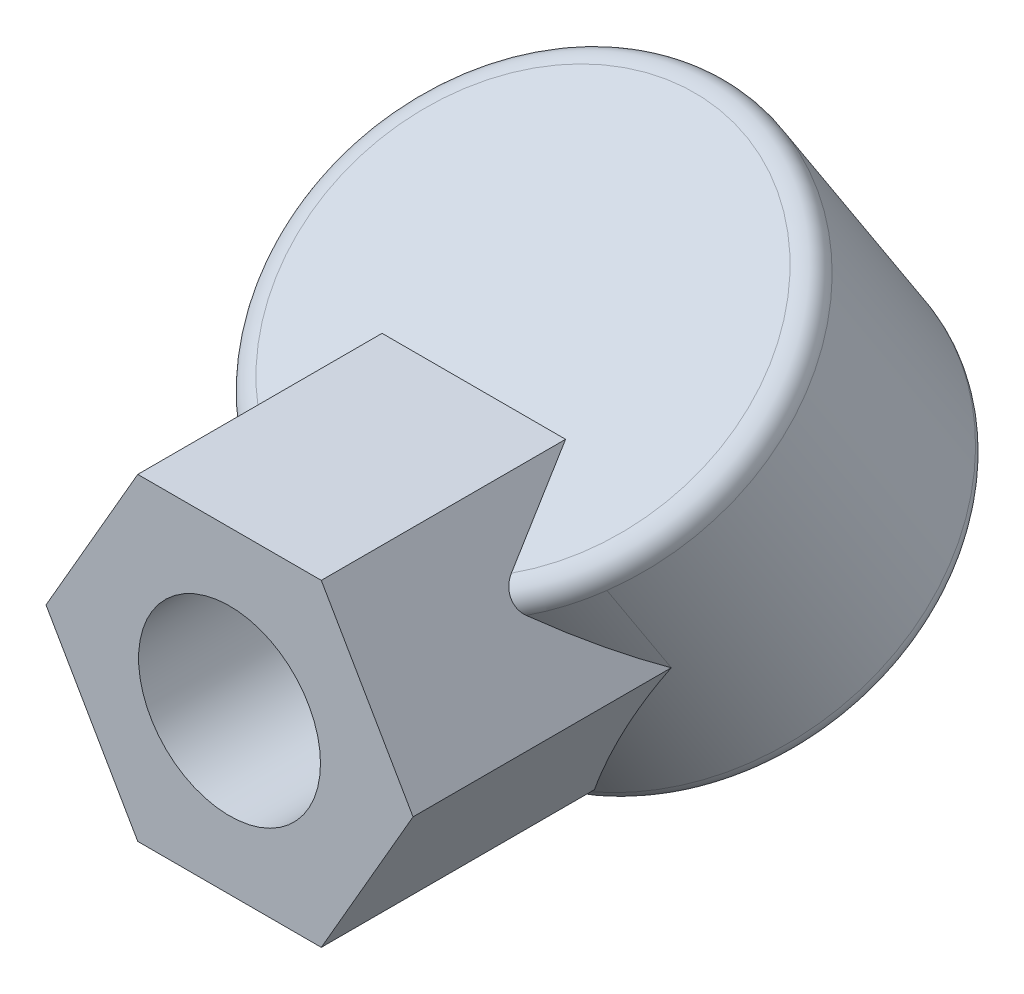
from build123d import *

# Parameters (mm, degrees)
DODANIE_WYCI_GNI_CIE2_REACH = 36.251
SZKIC5_R                    = 4
ZAOKR_GLENIE1_R             = 1


with BuildPart() as part:
    # Szkic3 → Obrót1 (revolve)
    with BuildSketch(Plane(origin=(0, 0, 0), x_dir=(0, 0, -1), z_dir=(1, 0, 0)), mode=Mode.PRIVATE) as obr_t1_sk:
        with BuildLine():
            Line((-7.080307455, 10.902717383), (-15.467013135, 5.456327033))
            Line((-15.467013135, 5.456327033), (-8.386705679, -5.44639035))
            Line((-8.386705679, -5.44639035), (-1.386705679, -6.861271556))
            ThreePointArc((-1.386705679, -6.861271556), (-6.87630729, -1.310113757), (-3.812473245, 5.870693976))
            Line((-3.812473245, 5.870693976), (-7.080307455, 10.902717383))
        make_face()
    revolve(obr_t1_sk.sketch.rotate(Axis((0, 5.870693976, 3.812473245), (0, 0.838670567945423, 0.5446390350150287)), 180), axis=Axis((0, 5.870693976, 3.812473245), (0, 0.838670567945423, 0.5446390350150287)))

    # Szkic5 → Dodanie-wyciągnięcie2 (add, up to next)
    with BuildSketch(Plane.XY.offset(20), mode=Mode.PRIVATE) as dodanie_wyci_gni_cie2_sk1:
        Polygon((8.082903769, 2.5), (4.047261819, 9.489936898), (-4.024022081, 9.489936898), (-8.059664031, 2.5), (-4.024022081, -4.489936898), (4.047261819, -4.489936898), align=None)
        with Locations((0.011619869, 2.5)):
            Circle(SZKIC5_R, mode=Mode.SUBTRACT)
    dodanie_wyci_gni_cie2_tool1 = extrude(dodanie_wyci_gni_cie2_sk1.sketch, amount=-DODANIE_WYCI_GNI_CIE2_REACH, mode=Mode.PRIVATE) - part.part
    add(dodanie_wyci_gni_cie2_tool1.solids().sort_by_distance((5.880146, 5.888195, 20))[0])

    # Zaokrąglenie1
    zaokr_glenie1_edges = [part.edges().sort_by_distance(p)[0] for p in [
        (0, -5.44639035, 8.386705679),
        (-9.529856548, 12.553057616, 4.539006353),
    ]]
    fillet(zaokr_glenie1_edges, radius=ZAOKR_GLENIE1_R)


solid = part.part
